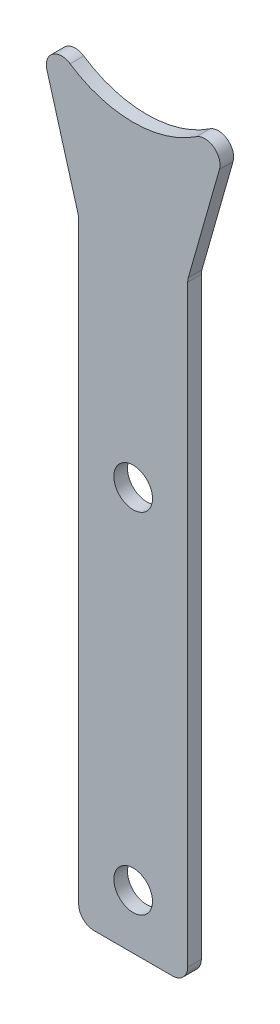
from build123d import *

# Parameters (mm, degrees)
SKETCH1_R            = 2.625
BOSS_EXTRUDE1_DEPTH  = 1.5875
FILLET1_R            = 1.778
M4_CLEARANCE_HOLE1_D = 4.5


with BuildPart() as part:
    # Sketch1 → Boss-Extrude1 (new body)
    # profile 1 of 3: a face of its own
    with BuildSketch(Plane.XY):
        with BuildLine():
            ThreePointArc((-14.144818028, 67.686446389), (-1.442639673, 58.098657577), (11.259538681, 67.686446389))
            Line((11.259538681, 67.686446389), (4.907360327, 45.398657577))
            Line((4.907360327, 45.398657577), (4.907360327, -25.721342423))
            Line((4.907360327, -25.721342423), (-7.792639673, -25.721342423))
            Line((-7.792639673, -25.721342423), (-7.792639673, 45.398657577))
            Line((-7.792639673, 45.398657577), (-14.144818028, 67.686446389))
        make_face()
        with Locations((-1.442639673, -19.371342423)):
            Circle(SKETCH1_R, mode=Mode.SUBTRACT)
        with Locations((-1.442639673, 21.268657577)):
            Circle(SKETCH1_R, mode=Mode.SUBTRACT)
    # profile 2 of 3: a face of its own
    with BuildSketch(Plane.XY):
        with Locations((-1.442639673, 21.268657577)):
            Circle(SKETCH1_R)
    # profile 3 of 3: a face of its own
    with BuildSketch(Plane.XY):
        with Locations((-1.442639673, -19.371342423)):
            Circle(SKETCH1_R)
    extrude(amount=BOSS_EXTRUDE1_DEPTH)

    # Fillet1
    fillet1_edges = [part.edges().sort_by_distance(p)[0] for p in [
        (11.259538681, 67.686446389, 0.79375),
        (4.907360327, 45.398657577, 0.79375),
        (4.907360327, -25.721342423, 0.79375),
        (-7.792639673, -25.721342423, 0.79375),
        (-7.792639673, 45.398657577, 0.79375),
        (-14.144818028, 67.686446389, 0.79375),
    ]]
    fillet(fillet1_edges, radius=FILLET1_R)

    # M4 Clearance Hole1 (through all)
    with Locations(Plane.XY.offset(1.5875)):
        with Locations((-1.442639673, -19.371342423), (-1.442639673, 21.268657577)):
            Hole(M4_CLEARANCE_HOLE1_D / 2)


solid = part.part
